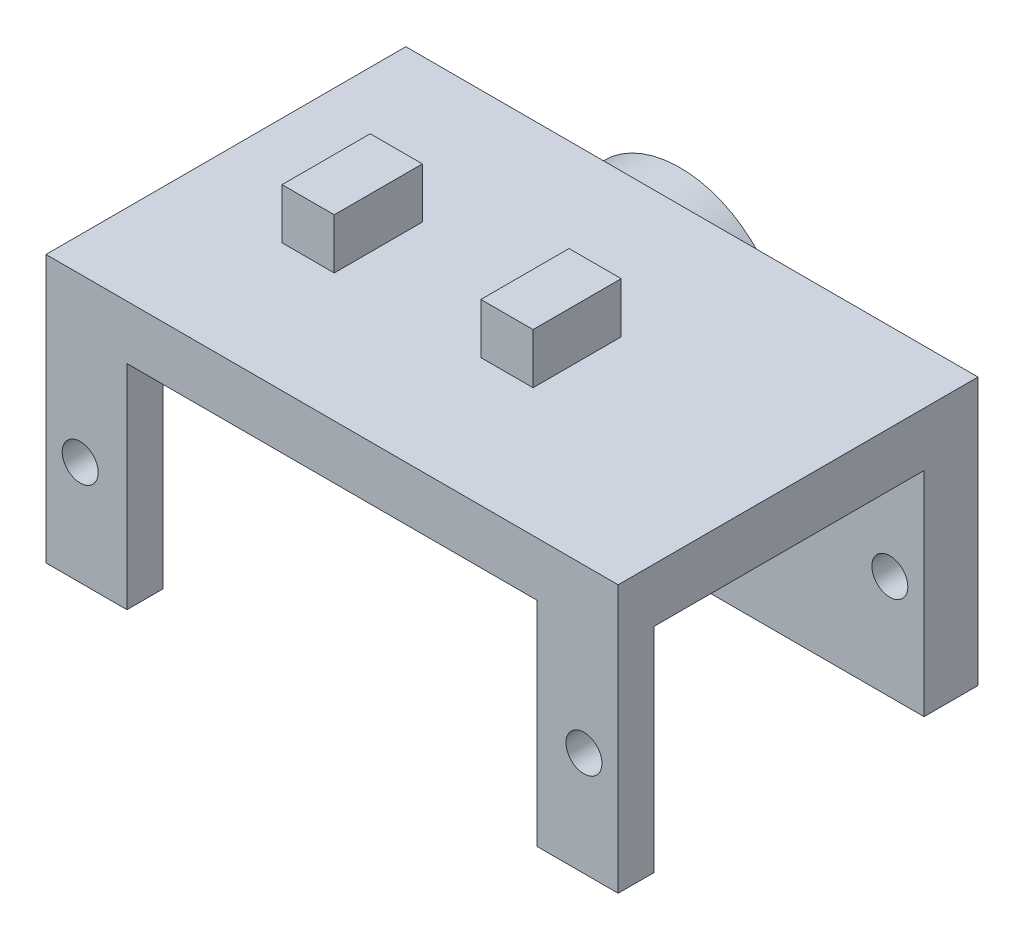
from build123d import *

# Parameters (mm, degrees)
SKETCH1_W            = 31.8
SKETCH1_H            = 13.25
BOSS_EXTRUDE3_DEPTH  = 3
SKETCH3_W            = 31.8
SKETCH3_H            = 3
BOSS_EXTRUDE4_DEPTH  = 24
SKETCH4_W            = 22.8
SKETCH4_H            = 13.25
CUT_EXTRUDE3_DEPTH   = 3
SKETCH6_W            = 31.8
SKETCH6_H            = 2
BOSS_EXTRUDE5_DEPTH  = 13.25
SKETCH7_W            = 3.6
SKETCH7_H            = 3
CUT_EXTRUDE4_DEPTH   = 40.30496947
SKETCH8_W            = 2
SKETCH8_H            = 1.25
BOSS_EXTRUDE6_DEPTH  = 31.8
SKETCH10_W           = 2
SKETCH10_H           = 17.5
CUT_EXTRUDE6_DEPTH   = 38.505207972
BOSS_EXTRUDE7_START  = -31.8
SKETCH11_W           = 3
SKETCH11_H           = 1.25
BOSS_EXTRUDE7_DEPTH  = 31.8
SKETCH12_W           = 22.8
SKETCH12_H           = 1.25
CUT_EXTRUDE7_DEPTH   = 4
SKETCH15_W           = 31.8
SKETCH15_H           = 3
BOSS_EXTRUDE9_DEPTH  = 17.5
BOSS_EXTRUDE12_DEPTH = 5
SKETCH20_W           = 15
SKETCH20_H           = 14.5
SKETCH20_W_2         = 5.230602644
SKETCH20_H_2         = 17.5
CUT_EXTRUDE9_DEPTH   = 100
SKETCH22_R           = 1
SKETCH22_W           = 31.8
SKETCH22_H           = 2.65
CUT_EXTRUDE11_DEPTH  = 20
SKETCH24_R           = 5.925
BOSS_EXTRUDE13_DEPTH = 4.8
SKETCH25_R           = 2.5
BOSS_EXTRUDE14_DEPTH = 2
SKETCH26_W           = 2.9
SKETCH26_H           = 4.9
BOSS_EXTRUDE15_DEPTH = 2.8


with BuildPart() as part:
    # Sketch1 → Boss-Extrude3 (new body)
    with BuildSketch(Plane.XY):
        Rectangle(SKETCH1_W, SKETCH1_H)
    extrude(amount=BOSS_EXTRUDE3_DEPTH)

    # Sketch3 → Boss-Extrude4 (add)
    with BuildSketch(Plane.XY.offset(3)):
        with Locations((0, 8.125)):
            Rectangle(SKETCH3_W, SKETCH3_H)
    extrude(amount=-BOSS_EXTRUDE4_DEPTH)

    # Sketch4 → Cut-Extrude3 (cut)
    with BuildSketch(Plane.XY.offset(3)):
        Rectangle(SKETCH4_W, SKETCH4_H)
    extrude(amount=-CUT_EXTRUDE3_DEPTH, mode=Mode.SUBTRACT)

    # Sketch6 → Boss-Extrude5 (add)
    with BuildSketch(Plane.XZ.offset(-6.625)):
        with Locations((0, -16.4)):
            Rectangle(SKETCH6_W, SKETCH6_H)
    extrude(amount=BOSS_EXTRUDE5_DEPTH)

    # Sketch7 → Cut-Extrude4 (cut, through all)
    with BuildSketch(Plane.ZY.offset(15.9)):
        with Locations((-19.2, 8.125)):
            Rectangle(SKETCH7_W, SKETCH7_H)
    extrude(amount=-CUT_EXTRUDE4_DEPTH, mode=Mode.SUBTRACT)

    # Sketch8 → Boss-Extrude6 (add)
    with BuildSketch(Plane(origin=(15.9, 0, 0), x_dir=(0, 0, -1), z_dir=(1, 0, 0))):
        with Locations((16.4, -7.25)):
            Rectangle(SKETCH8_W, SKETCH8_H)
    extrude(amount=-BOSS_EXTRUDE6_DEPTH)

    # Sketch10 → Cut-Extrude6 (cut, through all)
    with BuildSketch(Plane(origin=(15.9, 0, 0), x_dir=(0, 0, -1), z_dir=(1, 0, 0))):
        with Locations((16.4, 0.875)):
            Rectangle(SKETCH10_W, SKETCH10_H)
    extrude(amount=-CUT_EXTRUDE6_DEPTH, mode=Mode.SUBTRACT)

    # Sketch11 → Boss-Extrude7 (add)
    with BuildSketch(Plane(origin=(15.9, 0, 0), x_dir=(0, 0, -1), z_dir=(1, 0, 0)).offset(BOSS_EXTRUDE7_START)):
        with Locations((-1.5, -7.25)):
            Rectangle(SKETCH11_W, SKETCH11_H)
    boss_extrude7 = extrude(amount=BOSS_EXTRUDE7_DEPTH)

    # Mirror2: Boss-Extrude7 across plane
    add(boss_extrude7.mirror(Plane(origin=(0, 0, 0), x_dir=(0, 0, 1), z_dir=(1, 0, 0))))

    # Sketch12 → Cut-Extrude7 (cut)
    with BuildSketch(Plane.XY.offset(3)):
        with Locations((0, -7.25)):
            Rectangle(SKETCH12_W, SKETCH12_H)
    extrude(amount=-CUT_EXTRUDE7_DEPTH, mode=Mode.SUBTRACT)

    # Sketch15 → Boss-Extrude9 (add)
    with BuildSketch(Plane(origin=(0, 9.625, 0), x_dir=(1, 0, 0), z_dir=(0, 1, 0))):
        with Locations((0, 16.9)):
            Rectangle(SKETCH15_W, SKETCH15_H)
    extrude(amount=-BOSS_EXTRUDE9_DEPTH)

    # Sketch19 → Boss-Extrude12 (add)
    with BuildSketch(Plane.XY.offset(3)):
        Polygon((-15.9, 9.625), (15.9, 9.625), (15.9, -7.875), (11.4, -7.875), (11.4, 6.625), (-11.4, 6.625), (-11.4, -7.875), (-15.9, -7.875), align=None)
    extrude(amount=-BOSS_EXTRUDE12_DEPTH)

    # Sketch20 → Cut-Extrude9 (cut)
    with BuildSketch(Plane.ZY.offset(15.9)):
        with Locations((-7.9, -0.625)):
            Rectangle(SKETCH20_W, SKETCH20_H)
        with Locations((4.215301322, 0.875)):
            Rectangle(SKETCH20_W_2, SKETCH20_H_2)
    extrude(amount=-CUT_EXTRUDE9_DEPTH, mode=Mode.SUBTRACT)

    # Sketch22 → Cut-Extrude11 (cut)
    with BuildSketch(Plane.XY.offset(1.6)):
        with Locations((-14, 0.575)):
            Circle(SKETCH22_R)
        with Locations((14, 0.575)):
            Circle(SKETCH22_R)
        with Locations((0, -6.55)):
            Rectangle(SKETCH22_W, SKETCH22_H)
    extrude(amount=-CUT_EXTRUDE11_DEPTH, mode=Mode.SUBTRACT)

    # Sketch24 → Boss-Extrude13 (add)
    with BuildSketch(Plane(origin=(0, 0, -18.4), x_dir=(-1, 0, 0), z_dir=(0, 0, -1))):
        with Locations(Location((5.47, 0.7, 0), (0, 0, 270))):
            Circle(SKETCH24_R)
    extrude(amount=BOSS_EXTRUDE13_DEPTH)

    # Sketch25 → Boss-Extrude14 (add)
    with BuildSketch(Plane(origin=(0, 0, -23.2), x_dir=(-1, 0, 0), z_dir=(0, 0, -1))):
        with Locations((5.47, 0.7)):
            Circle(SKETCH25_R)
    extrude(amount=BOSS_EXTRUDE14_DEPTH)

    # Sketch26 → Boss-Extrude15 (add)
    with BuildSketch(Plane(origin=(0, 9.625, 0), x_dir=(1, 0, 0), z_dir=(0, 1, 0))):
        with Locations((-8.45, 7.97)):
            Rectangle(SKETCH26_W, SKETCH26_H)
        with Locations((2.6, 7.97)):
            Rectangle(SKETCH26_W, SKETCH26_H)
    extrude(amount=BOSS_EXTRUDE15_DEPTH)


solid = part.part
